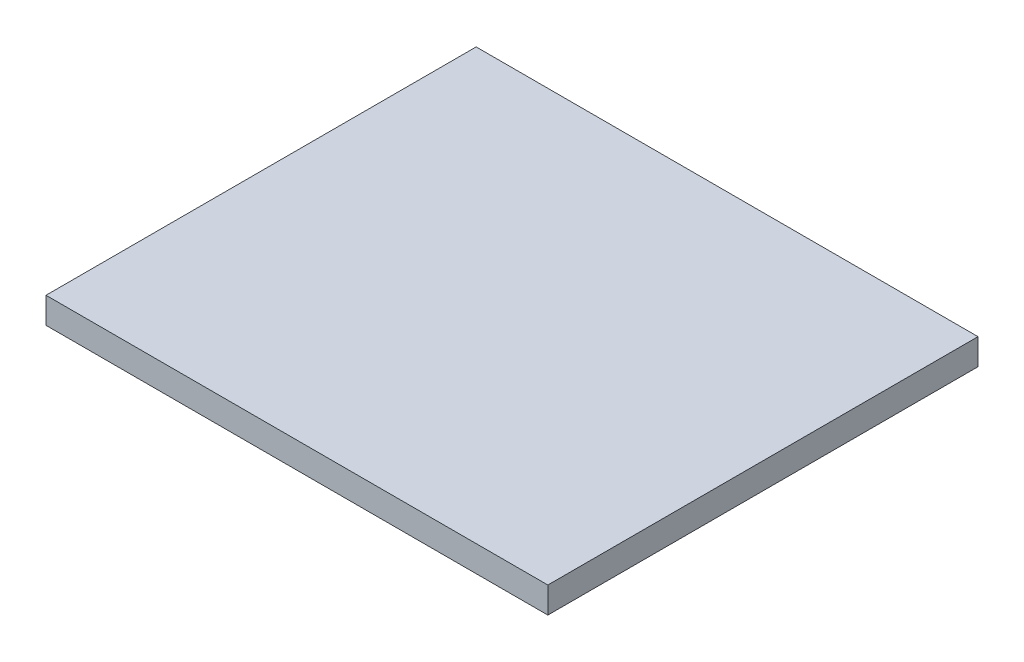
from build123d import *

# Parameters (mm, degrees)
SKETCH1_W           = 38.5
SKETCH1_H           = 33
BOSS_EXTRUDE1_DEPTH = 2


with BuildPart() as part:
    # Sketch1 → Boss-Extrude1 (new body)
    with BuildSketch(Plane(origin=(0, 0, 0), x_dir=(1, 0, 0), z_dir=(0, 1, 0))):
        Rectangle(SKETCH1_W, SKETCH1_H)
    extrude(amount=BOSS_EXTRUDE1_DEPTH)


solid = part.part
